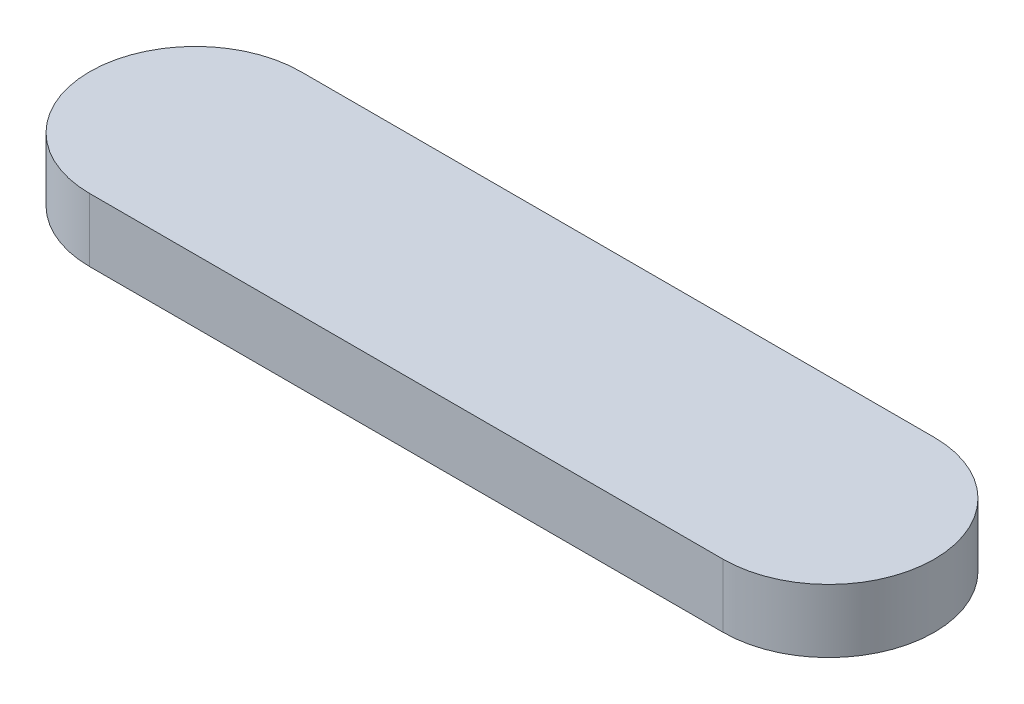
from build123d import *

# Parameters (mm, degrees)
EXTRUDE_1_DEPTH = 3


with BuildPart() as part:
    # 草图1 → 凸台-拉伸1 (new body)
    with BuildSketch(Plane(origin=(0, 0, 0), x_dir=(1, 0, 0), z_dir=(0, 1, 0))):
        with BuildLine():
            Line((0, 5), (30, 5))
            ThreePointArc((30, 5), (35, 0), (30, -5))
            Line((30, -5), (0, -5))
            ThreePointArc((0, -5), (-5, 0), (0, 5))
        make_face()
    extrude(amount=EXTRUDE_1_DEPTH)


solid = part.part
